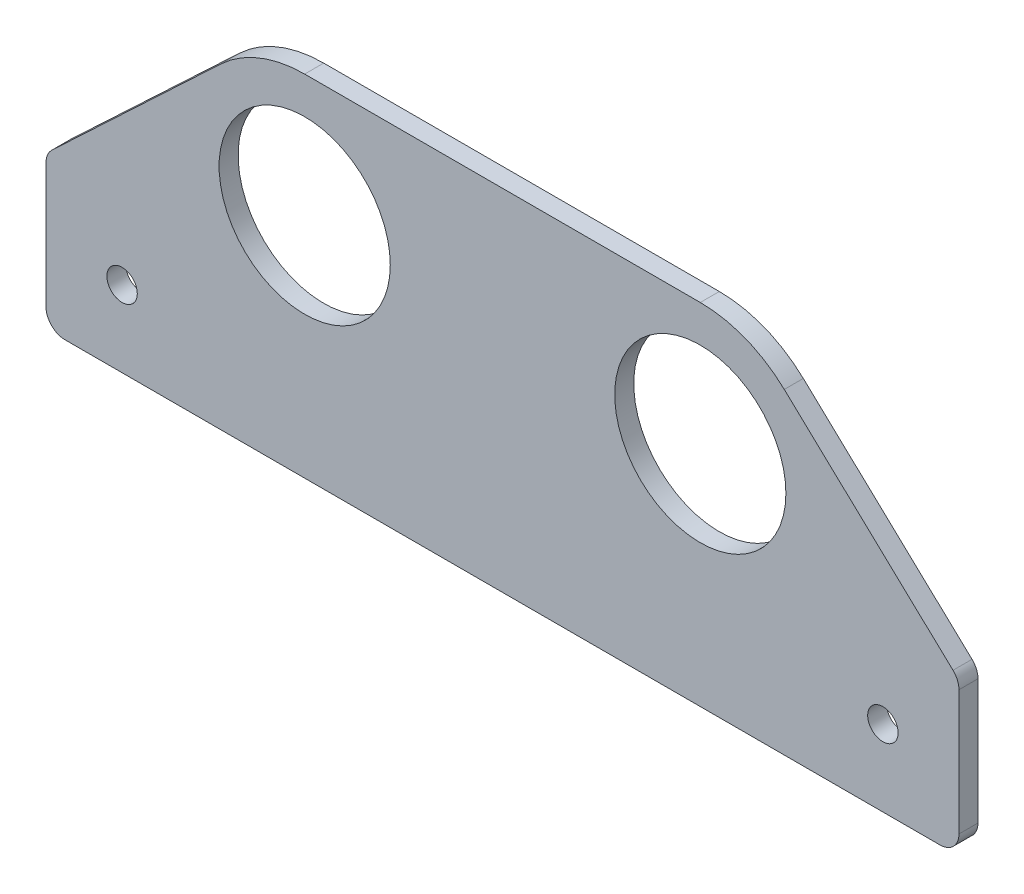
from build123d import *

# Parameters (mm, degrees)
SKETCH1_R           = 14.2875
SKETCH1_R_2         = 2.54
BOSS_EXTRUDE1_DEPTH = 3.175
FILLET1_R           = 3.175


with BuildPart() as part:
    # Sketch1 → Boss-Extrude1 (new body)
    with BuildSketch(Plane.XY):
        with BuildLine():
            Line((0, 0), (152.4, 0))
            Line((152.4, 0), (152.4, 25.4))
            Line((152.4, 25.4), (123.236852256, 52.859492597))
            ThreePointArc((123.236852256, 52.859492597), (116.759751152, 56.979103271), (109.22, 58.42))
            Line((109.22, 58.42), (43.18, 58.42))
            ThreePointArc((43.18, 58.42), (35.640248848, 56.979103271), (29.163147744, 52.859492597))
            Line((29.163147744, 52.859492597), (0, 25.4))
            Line((0, 25.4), (0, 0))
        make_face()
        with Locations((43.18, 37.973)):
            Circle(SKETCH1_R, mode=Mode.SUBTRACT)
        with Locations((109.22, 37.973)):
            Circle(SKETCH1_R, mode=Mode.SUBTRACT)
        with Locations((12.7, 12.7)):
            Circle(SKETCH1_R_2, mode=Mode.SUBTRACT)
        with Locations((139.7, 12.7)):
            Circle(SKETCH1_R_2, mode=Mode.SUBTRACT)
    extrude(amount=BOSS_EXTRUDE1_DEPTH)

    # Fillet1
    fillet1_edges = [part.edges().sort_by_distance(p)[0] for p in [
        (0, 25.4, 1.5875),
        (152.4, 25.4, 1.5875),
        (152.4, 0, 1.5875),
        (0, 0, 1.5875),
    ]]
    fillet(fillet1_edges, radius=FILLET1_R)


solid = part.part
